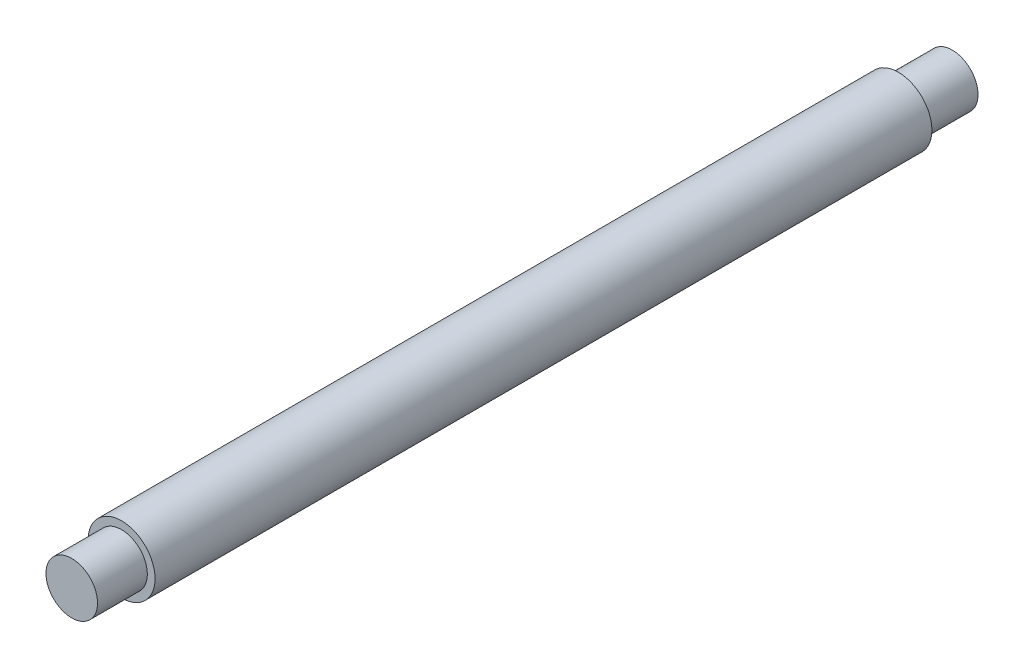
from build123d import *

# Parameters (mm, degrees)
SKETCH_1_R      = 1.925
EXTRUDE_1_DEPTH = 3.72
SKETCH_2_R      = 2.5
EXTRUDE_2_DEPTH = 58
EXTRUDE_START   = 4.02
SKETCH_3_R      = 1.925
EXTRUDE_3_DEPTH = 4.02


with BuildPart() as part:
    # 草图1 → 凸台-拉伸1 (new body)
    with BuildSketch(Plane.XY):
        Circle(SKETCH_1_R)
    extrude(amount=EXTRUDE_1_DEPTH)

    # 草图2 → 凸台-拉伸2 (add)
    with BuildSketch(Plane(origin=(0, 0, 0), x_dir=(-1, 0, 0), z_dir=(0, 0, -1))):
        with Locations(Location((0, 0, 0), (0, 0, 180))):
            Circle(SKETCH_2_R)
    extrude(amount=EXTRUDE_2_DEPTH)

    # 草图3 → 凸台-拉伸3 (add)
    with BuildSketch(Plane(origin=(0, 0, -58), x_dir=(-1, 0, 0), z_dir=(0, 0, -1)).offset(EXTRUDE_START)):
        with Locations(Location((0, 0, 0), (0, 0, 180))):
            Circle(SKETCH_3_R)
    extrude(amount=-EXTRUDE_3_DEPTH)


solid = part.part
